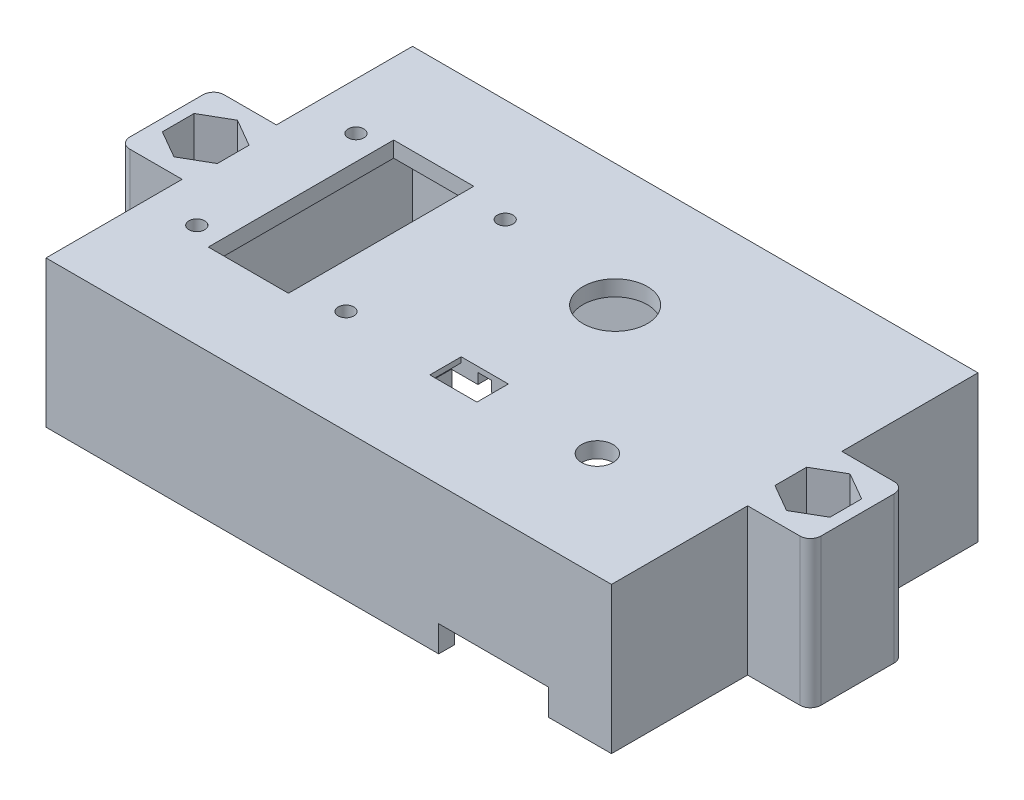
from build123d import *

# Parameters (mm, degrees)
SKETCH2_W           = 108
SKETCH2_H           = 70
BOSS_EXTRUDE1_DEPTH = 3
SKETCH7_W           = 108
SKETCH7_H           = 70
SKETCH7_W_2         = 102
SKETCH7_H_2         = 64
BOSS_EXTRUDE4_DEPTH = 25
SKETCH16_W          = 2
SKETCH16_H          = 10
SKETCH16_W_2        = 8
SKETCH16_H_2        = 3
SKETCH16_W_3        = 4
SKETCH16_H_3        = 2
BOSS_EXTRUDE5_DEPTH = 22.8
SKETCH19_W          = 6
SKETCH19_H          = 19.4
CUT_EXTRUDE10_DEPTH = 1
SKETCH18_R          = 1.5
SKETCH18_W          = 15.3
SKETCH18_H          = 35.4
CUT_EXTRUDE9_DEPTH  = 79.242054464
BOSS_EXTRUDE6_START = 1.5
SKETCH20_W          = 6
SKETCH20_H          = 10
SKETCH20_R          = 1.5
SKETCH20_R_2        = 2
BOSS_EXTRUDE6_DEPTH = 1.5
SKETCH21_W          = 9
SKETCH21_H          = 6
CUT_EXTRUDE11_DEPTH = 1
SKETCH23_W          = 2.627
SKETCH23_H          = 3.127
SKETCH23_W_2        = 12.754
SKETCH23_H_2        = 6
CUT_EXTRUDE13_DEPTH = 2
SKETCH24_R          = 6.15
SKETCH24_R_2        = 3
CUT_EXTRUDE14_DEPTH = 80.251618827
SKETCH28_W          = 21
SKETCH28_H          = 3
CUT_EXTRUDE15_DEPTH = 5
SKETCH31_W          = 12
SKETCH31_H          = 18
SKETCH31_R          = 3.25
BOSS_EXTRUDE8_DEPTH = 28
FILLET1_R           = 2
CUT_EXTRUDE17_DEPTH = 10


with BuildPart() as part:
    # Sketch2 → Boss-Extrude1 (new body)
    with BuildSketch(Plane(origin=(0, 0, 0), x_dir=(1, 0, 0), z_dir=(0, 1, 0))):
        with Locations((-7.038444533, 7.084764176)):
            Rectangle(SKETCH2_W, SKETCH2_H)
    extrude(amount=BOSS_EXTRUDE1_DEPTH)

    # Sketch7 → Boss-Extrude4 (add)
    with BuildSketch(Plane(origin=(0, 0, 0), x_dir=(-1, 0, 0), z_dir=(0, -1, 0))):
        with Locations((7.038444533, 7.084764176)):
            Rectangle(SKETCH7_W, SKETCH7_H)
        with Locations((7.038444533, 7.084764176)):
            Rectangle(SKETCH7_W_2, SKETCH7_H_2, mode=Mode.SUBTRACT)
    extrude(amount=BOSS_EXTRUDE4_DEPTH)

    # Sketch16 → Boss-Extrude5 (add)
    with BuildSketch(Plane.XZ):
        with Locations((-16.038444533, 3.415235824)):
            Rectangle(SKETCH16_W, SKETCH16_H)
        Polygon((-58.038444533, 14.915235824), (-55.038444533, 14.915235824), (-55.038444533, 21.915235824), (-55.038444533, 24.915235824), (-58.038444533, 24.915235824), align=None)
        with Locations((-51.038444533, 23.415235824)):
            Rectangle(SKETCH16_W_2, SKETCH16_H_2)
        with Locations((-17.038444533, -2.584764176)):
            Rectangle(SKETCH16_W_3, SKETCH16_H_3)
    extrude(amount=BOSS_EXTRUDE5_DEPTH)

    # Sketch19 → Cut-Extrude10 (cut)
    with BuildSketch(Plane.XZ):
        with Locations((-52.538444533, -7.084764176)):
            Rectangle(SKETCH19_W, SKETCH19_H)
    extrude(amount=-CUT_EXTRUDE10_DEPTH, mode=Mode.SUBTRACT)

    # Sketch18 → Cut-Extrude9 (cut, through all)
    with BuildSketch(Plane.XZ):
        with Locations(Location((-52.038444533, -22.284764176, 0), (0, 0, 270))):
            Circle(SKETCH18_R)
        with Locations(Location((-23.538444533, -22.284764176, 0), (0, 0, 270))):
            Circle(SKETCH18_R)
        with Locations(Location((-23.538444533, 8.115235824, 0), (0, 0, 270))):
            Circle(SKETCH18_R)
        with Locations(Location((-52.038444533, 8.115235824, 0), (0, 0, 270))):
            Circle(SKETCH18_R)
        with Locations((-39.688444533, -7.084764176)):
            Rectangle(SKETCH18_W, SKETCH18_H)
    extrude(amount=-CUT_EXTRUDE9_DEPTH, mode=Mode.SUBTRACT)

    # Sketch20 → Boss-Extrude6 (add)
    # profile 1 of 4: a face of its own
    with BuildSketch(Plane.XZ.offset(BOSS_EXTRUDE6_START)):
        with Locations((-52.538444533, 7.615235824)):
            Rectangle(SKETCH20_W, SKETCH20_H)
        with Locations(Location((-52.038444533, 8.115235824, 0), (0, 0, 270))):
            Circle(SKETCH20_R, mode=Mode.SUBTRACT)
    # profile 2 of 4: a face of its own
    with BuildSketch(Plane.XZ.offset(BOSS_EXTRUDE6_START)):
        with Locations((-52.538444533, -21.784764176)):
            Rectangle(SKETCH20_W, SKETCH20_H)
        with Locations(Location((-52.038444533, -22.284764176, 0), (0, 0, 270))):
            Circle(SKETCH20_R_2, mode=Mode.SUBTRACT)
    # profile 3 of 4: a face of its own
    with BuildSketch(Plane.XZ.offset(BOSS_EXTRUDE6_START)):
        with Locations((-23.038444533, -21.784764176)):
            Rectangle(SKETCH20_W, SKETCH20_H)
        with Locations(Location((-23.538444533, -22.284764176, 0), (0, 0, 270))):
            Circle(SKETCH20_R_2, mode=Mode.SUBTRACT)
    # profile 4 of 4: a face of its own
    with BuildSketch(Plane.XZ.offset(BOSS_EXTRUDE6_START)):
        with Locations((-23.038444533, 7.615235824)):
            Rectangle(SKETCH20_W, SKETCH20_H)
        with Locations(Location((-23.538444533, 8.115235824, 0), (0, 0, 270))):
            Circle(SKETCH20_R_2, mode=Mode.SUBTRACT)
    extrude(amount=-BOSS_EXTRUDE6_DEPTH)

    # Sketch21 → Cut-Extrude11 (cut)
    with BuildSketch(Plane.XZ.offset(-3)):
        with Locations((-0.538444533, 7.615235824)):
            Rectangle(SKETCH21_W, SKETCH21_H)
    extrude(amount=CUT_EXTRUDE11_DEPTH, mode=Mode.SUBTRACT)

    # Sketch23 → Cut-Extrude13 (cut)
    with BuildSketch(Plane.XZ):
        with Locations((-0.538444533, 3.051735824)):
            Rectangle(SKETCH23_W, SKETCH23_H)
        with Locations((-0.538444533, 7.615235824)):
            Rectangle(SKETCH23_W_2, SKETCH23_H_2)
    extrude(amount=-CUT_EXTRUDE13_DEPTH, mode=Mode.SUBTRACT)

    # Sketch24 → Cut-Extrude14 (cut, through all)
    with BuildSketch(Plane(origin=(0, 3, 0), x_dir=(1, 0, 0), z_dir=(0, 1, 0))):
        with Locations(Location((1.111555467, 18.634764176, 0), (0, 0, 270))):
            Circle(SKETCH24_R)
        with Locations(Location((23.961555467, -7.615235824, 0), (0, 0, 270))):
            Circle(SKETCH24_R_2)
    extrude(amount=-CUT_EXTRUDE14_DEPTH, mode=Mode.SUBTRACT)

    # Sketch28 → Cut-Extrude15 (cut)
    with BuildSketch(Plane.XZ.offset(25)):
        with Locations((24.461555467, 26.415235824)):
            Rectangle(SKETCH28_W, SKETCH28_H)
    extrude(amount=-CUT_EXTRUDE15_DEPTH, mode=Mode.SUBTRACT)

    # Sketch31 → Boss-Extrude8 (add)
    # profile 1 of 2: a face of its own
    with BuildSketch(Plane.XZ.offset(25)):
        with Locations((-67.038444533, -7.084764176)):
            Rectangle(SKETCH31_W, SKETCH31_H)
        with Locations(Location((-65.538444533, -7.084764176, 0), (0, 0, 270))):
            Circle(SKETCH31_R, mode=Mode.SUBTRACT)
    # profile 2 of 2: a face of its own
    with BuildSketch(Plane.XZ.offset(25)):
        with Locations((52.961555467, -7.084764176)):
            Rectangle(SKETCH31_W, SKETCH31_H)
        with Locations(Location((51.461555467, -7.084764176, 0), (0, 0, 90))):
            Circle(SKETCH31_R, mode=Mode.SUBTRACT)
    extrude(amount=-BOSS_EXTRUDE8_DEPTH)

    # Fillet1
    fillet1_edges = [part.edges().sort_by_distance(p)[0] for p in [
        (-73.038444533, -11, -16.084764176),
        (-73.038444533, -11, 1.915235824),
        (58.961555467, -11, 1.915235824),
        (58.961555467, -11, -16.084764176),
    ]]
    fillet(fillet1_edges, radius=FILLET1_R)

    # Sketch32 → Cut-Extrude17 (cut)
    with BuildSketch(Plane(origin=(0, 3, 0), x_dir=(1, 0, 0), z_dir=(0, 1, 0))):
        Polygon((-60.288444533, 4.053675263), (-60.288444533, 10.115853089), (-65.538444533, 13.146942003), (-70.788444533, 10.115853089), (-70.788444533, 4.053675263), (-65.538444533, 1.02258635), align=None)
        Polygon((51.461555467, 1.02258635), (46.211555467, 4.053675263), (46.211555467, 10.115853089), (51.461555467, 13.146942003), (56.711555467, 10.115853089), (56.711555467, 4.053675263), align=None)
    extrude(amount=-CUT_EXTRUDE17_DEPTH, mode=Mode.SUBTRACT)


solid = part.part
